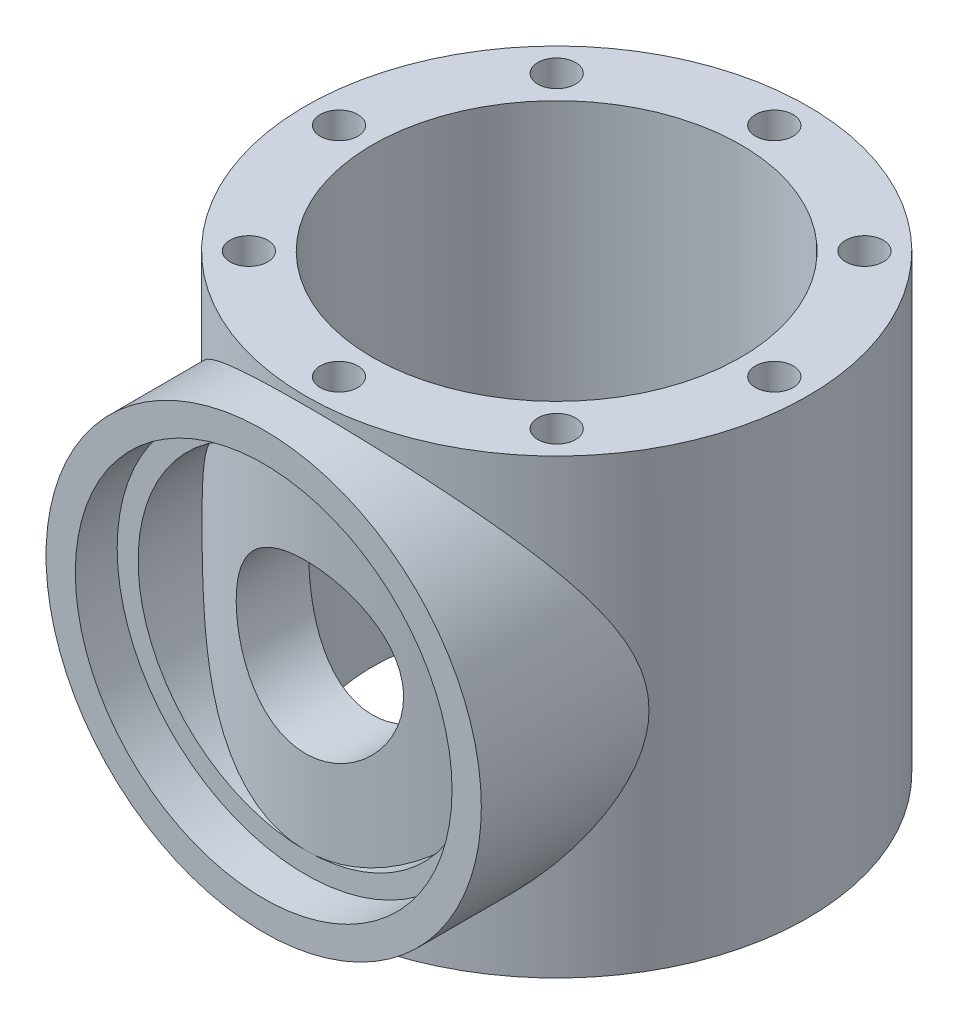
from build123d import *

# Parameters (mm, degrees)
SKETCH_1_R                 = 30
SKETCH_1_R_2               = 22
EXTRUDE_1_DEPTH            = 54
HOLE_WIZARD_M41_AT_2_COUNT = 2
HOLE_WIZARD_M41_AT_2_PITCH = 19.899538483
HOLE_WIZARD_M41_AT_3_COUNT = 2
HOLE_WIZARD_M41_AT_3_PITCH = 36.769552622
HOLE_WIZARD_M41_AT_4_COUNT = 2
HOLE_WIZARD_M41_AT_4_PITCH = 48.041735691
HOLE_WIZARD_M41_AT_5_COUNT = 2
HOLE_WIZARD_M41_AT_5_PITCH = 52
HOLE_WIZARD_M41_AT_6_COUNT = 2
HOLE_WIZARD_M41_AT_6_PITCH = 48.041735691
HOLE_WIZARD_M41_AT_7_COUNT = 2
HOLE_WIZARD_M41_AT_7_PITCH = 36.769552622
HOLE_WIZARD_M41_AT_8_COUNT = 2
HOLE_WIZARD_M41_AT_8_PITCH = 19.899538483
EXTRUDE_2_REACH            = 91.672
EXTRUDE_2_END_RADIUS       = 30
SKETCH_7_R                 = 26
SKETCH_7_R_2               = 20
SKETCH_9_R                 = 22.5
CUT_EXTRUDE_3_DEPTH        = 5
SKETCH_10_R                = 10
CUT_EXTRUDE_4_DEPTH        = 15


with BuildPart() as part:
    # Эскиз1 → Бобышка-Вытянуть1 (new body)
    with BuildSketch(Plane(origin=(0, 0, 0), x_dir=(1, 0, 0), z_dir=(0, 1, 0))):
        with Locations(Location((0, 0, 0), (0, 0, 270))):
            Circle(SKETCH_1_R)
        with Locations(Location((0, 0, 0), (0, 0, 270))):
            Circle(SKETCH_1_R_2, mode=Mode.SUBTRACT)
    extrude(amount=EXTRUDE_1_DEPTH)

    # Эскиз5 → Отверстие с зазором M41 (revolve, cut)
    with BuildSketch(Plane(origin=(-18.384776311, 54, -18.384776311), x_dir=(0, 0, 1), z_dir=(1, 0, 0))):
        Polygon((0, 0), (0, 13.351936393), (2.25, 12), (2.25, 0), align=None)
    hole_wizard_m41 = revolve(axis=Axis((-18.384776311, 60.35, -18.384776311), (0, -1, 0)), mode=Mode.SUBTRACT)

    # Отверстие с зазором M41 at 2: Отверстие с зазором M41 ×2
    with Locations(*[Vector(0.9238795325112705, 0, -0.38268343236512914) * (i * HOLE_WIZARD_M41_AT_2_PITCH) for i in range(1, HOLE_WIZARD_M41_AT_2_COUNT)]):
        add(hole_wizard_m41, mode=Mode.SUBTRACT)

    # Отверстие с зазором M41 at 3: Отверстие с зазором M41 ×2
    with Locations(*[(i * HOLE_WIZARD_M41_AT_3_PITCH, 0, 0) for i in range(1, HOLE_WIZARD_M41_AT_3_COUNT)]):
        add(hole_wizard_m41, mode=Mode.SUBTRACT)

    # Отверстие с зазором M41 at 4: Отверстие с зазором M41 ×2
    with Locations(*[Vector(0.9238795325113031, 0, 0.3826834323650504) * (i * HOLE_WIZARD_M41_AT_4_PITCH) for i in range(1, HOLE_WIZARD_M41_AT_4_COUNT)]):
        add(hole_wizard_m41, mode=Mode.SUBTRACT)

    # Отверстие с зазором M41 at 5: Отверстие с зазором M41 ×2
    with Locations(*[Vector(0.7071067811865778, 0, 0.7071067811865174) * (i * HOLE_WIZARD_M41_AT_5_PITCH) for i in range(1, HOLE_WIZARD_M41_AT_5_COUNT)]):
        add(hole_wizard_m41, mode=Mode.SUBTRACT)

    # Отверстие с зазором M41 at 6: Отверстие с зазором M41 ×2
    with Locations(*[Vector(0.38268343236512914, 0, 0.9238795325112705) * (i * HOLE_WIZARD_M41_AT_6_PITCH) for i in range(1, HOLE_WIZARD_M41_AT_6_COUNT)]):
        add(hole_wizard_m41, mode=Mode.SUBTRACT)

    # Отверстие с зазором M41 at 7: Отверстие с зазором M41 ×2
    with Locations(*[(0, 0, i * HOLE_WIZARD_M41_AT_7_PITCH) for i in range(1, HOLE_WIZARD_M41_AT_7_COUNT)]):
        add(hole_wizard_m41, mode=Mode.SUBTRACT)

    # Отверстие с зазором M41 at 8: Отверстие с зазором M41 ×2
    with Locations(*[Vector(-0.3826834323650503, 0, 0.9238795325113031) * (i * HOLE_WIZARD_M41_AT_8_PITCH) for i in range(1, HOLE_WIZARD_M41_AT_8_COUNT)]):
        add(hole_wizard_m41, mode=Mode.SUBTRACT)

    # Зеркальное отражение1: Отверстие с зазором M41 across plane
    add(hole_wizard_m41.mirror(Plane.ZX.offset(27)), mode=Mode.SUBTRACT)

    # Зеркальное отражение1 copy 1 sketch → Зеркальное отражение1 copy 1 (revolve, cut)
    with BuildSketch(Plane(origin=(0, 0, -26), x_dir=(0, 0, 1), z_dir=(1, 0, 0))):
        Polygon((0, 0), (0, -13.351936393), (2.25, -12), (2.25, 0), align=None)
    revolve(axis=Axis((0, -6.35, -26), (0, -1, 0)), mode=Mode.SUBTRACT)

    # Зеркальное отражение1 copy 2 sketch → Зеркальное отражение1 copy 2 (revolve, cut)
    with BuildSketch(Plane(origin=(18.384776311, 0, -18.384776311), x_dir=(0, 0, 1), z_dir=(1, 0, 0))):
        Polygon((0, 0), (0, -13.351936393), (2.25, -12), (2.25, 0), align=None)
    revolve(axis=Axis((18.384776311, -6.35, -18.384776311), (0, -1, 0)), mode=Mode.SUBTRACT)

    # Зеркальное отражение1 copy 3 sketch → Зеркальное отражение1 copy 3 (revolve, cut)
    with BuildSketch(Plane(origin=(26, 0, 0), x_dir=(0, 0, 1), z_dir=(1, 0, 0))):
        Polygon((0, 0), (0, -13.351936393), (2.25, -12), (2.25, 0), align=None)
    revolve(axis=Axis((26, -6.35, 0), (0, -1, 0)), mode=Mode.SUBTRACT)

    # Зеркальное отражение1 copy 4 sketch → Зеркальное отражение1 copy 4 (revolve, cut)
    with BuildSketch(Plane(origin=(18.384776311, 0, 18.384776311), x_dir=(0, 0, 1), z_dir=(1, 0, 0))):
        Polygon((0, 0), (0, -13.351936393), (2.25, -12), (2.25, 0), align=None)
    revolve(axis=Axis((18.384776311, -6.35, 18.384776311), (0, -1, 0)), mode=Mode.SUBTRACT)

    # Зеркальное отражение1 copy 5 sketch → Зеркальное отражение1 copy 5 (revolve, cut)
    with BuildSketch(Plane(origin=(0, 0, 26), x_dir=(0, 0, 1), z_dir=(1, 0, 0))):
        Polygon((0, 0), (0, -13.351936393), (2.25, -12), (2.25, 0), align=None)
    revolve(axis=Axis((0, -6.35, 26), (0, -1, 0)), mode=Mode.SUBTRACT)

    # Зеркальное отражение1 copy 6 sketch → Зеркальное отражение1 copy 6 (revolve, cut)
    with BuildSketch(Plane(origin=(-18.384776311, 0, 18.384776311), x_dir=(0, 0, 1), z_dir=(1, 0, 0))):
        Polygon((0, 0), (0, -13.351936393), (2.25, -12), (2.25, 0), align=None)
    revolve(axis=Axis((-18.384776311, -6.35, 18.384776311), (0, -1, 0)), mode=Mode.SUBTRACT)

    # Зеркальное отражение1 copy 7 sketch → Зеркальное отражение1 copy 7 (revolve, cut)
    with BuildSketch(Plane(origin=(-26, 0, 0), x_dir=(0, 0, 1), z_dir=(1, 0, 0))):
        Polygon((0, 0), (0, -13.351936393), (2.25, -12), (2.25, 0), align=None)
    revolve(axis=Axis((-26, -6.35, 0), (0, -1, 0)), mode=Mode.SUBTRACT)

    # Бобышка-Вытянуть2: up to this cylinder (the profile starts outside it)
    extrude_2_end = Plane(origin=(0, 27, 0), z_dir=(0, -1, 0)) * Cylinder(EXTRUDE_2_END_RADIUS, 244.344, mode=Mode.PRIVATE)
    # Эскиз7 → Бобышка-Вытянуть2 (add, up to the surface)
    with BuildSketch(Plane.XY.offset(35), mode=Mode.PRIVATE) as extrude_2_sk1:
        with Locations((0, 27)):
            Circle(SKETCH_7_R)
        with Locations((0, 27)):
            Circle(SKETCH_7_R_2, mode=Mode.SUBTRACT)
    extrude_2_tool1 = extrude(extrude_2_sk1.sketch, amount=-EXTRUDE_2_REACH, mode=Mode.PRIVATE) - extrude_2_end
    add(extrude_2_tool1.solids().sort_by_distance((-25.264609, 27, 35))[0])

    # Эскиз9 → Вырез-Вытянуть3 (cut)
    with BuildSketch(Plane.XY.offset(35)):
        with Locations((0, 27)):
            Circle(SKETCH_9_R)
    extrude(amount=-CUT_EXTRUDE_3_DEPTH, mode=Mode.SUBTRACT)

    # Эскиз10 → Вырез-Вытянуть4 (cut)
    with BuildSketch(Plane.XY.offset(30)):
        with Locations((0, 27)):
            Circle(SKETCH_10_R)
    extrude(amount=-CUT_EXTRUDE_4_DEPTH, mode=Mode.SUBTRACT)


solid = part.part
